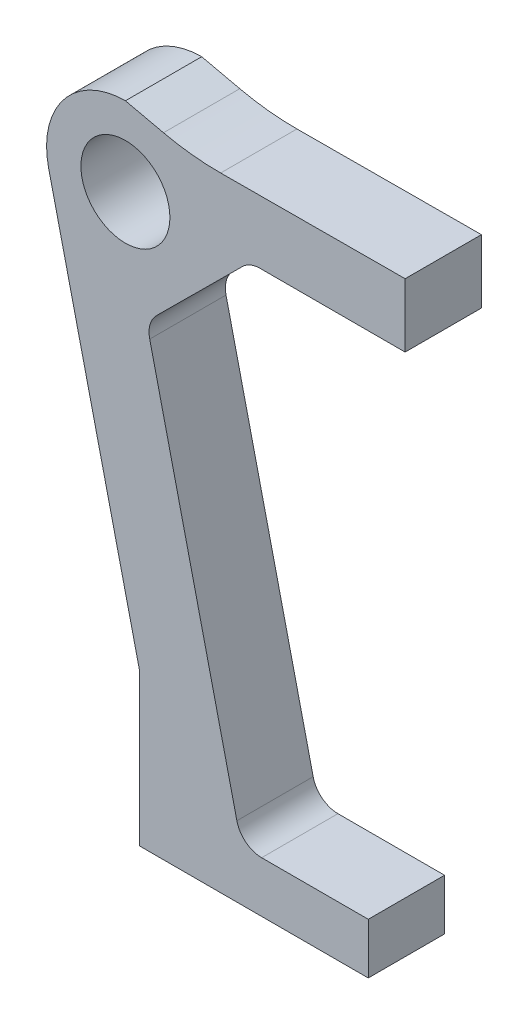
from build123d import *

# Parameters (mm, degrees)
BOSS_EXTRU_1_START = 0.2
ESQUISSE1_R        = 1.75
BOSS_EXTRU_1_DEPTH = 3


with BuildPart() as part:
    # Esquisse1 → Boss.-Extru.1 (new body)
    with BuildSketch(Plane.XY.offset(BOSS_EXTRU_1_START)):
        with BuildLine():
            Line((0.981089506, 13.370599952), (4.55, -1.925))
            Line((4.55, -1.925), (4.55, -7.925))
            Line((4.55, -7.925), (13.55, -7.925))
            Line((13.55, -7.925), (13.55, -5.925))
            Line((13.55, -5.925), (9.357429757, -5.925))
            ThreePointArc((9.357429757, -5.925), (8.735829332, -5.708334482), (8.383587662, -5.152225822))
            Line((8.383587662, -5.152225822), (4.956202513, 9.536826262))
            ThreePointArc((4.956202513, 9.536826262), (4.968859947, 10.039957952), (5.224987097, 10.473202214))
            Line((5.224987097, 10.473202214), (8.596002843, 13.824763284))
            ThreePointArc((8.596002843, 13.824763284), (8.91971414, 14.040045447), (9.301060354, 14.115613154))
            Line((9.301060354, 14.115613154), (15, 14.115613154))
            Line((15, 14.115613154), (15, 16.615613154))
            Line((15, 16.615613154), (7.745530511, 16.588352798))
            ThreePointArc((7.745530511, 16.588352798), (6.614685245, 16.648223613), (5.49786, 16.835565296))
            Line((5.49786, 16.835565296), (4, 17.175))
            ThreePointArc((4, 17.175), (1.571663105, 16.001961319), (0.981089506, 13.370599952))
        make_face()
        with Locations((4, 14.075)):
            Circle(ESQUISSE1_R, mode=Mode.SUBTRACT)
    extrude(amount=BOSS_EXTRU_1_DEPTH)


solid = part.part
